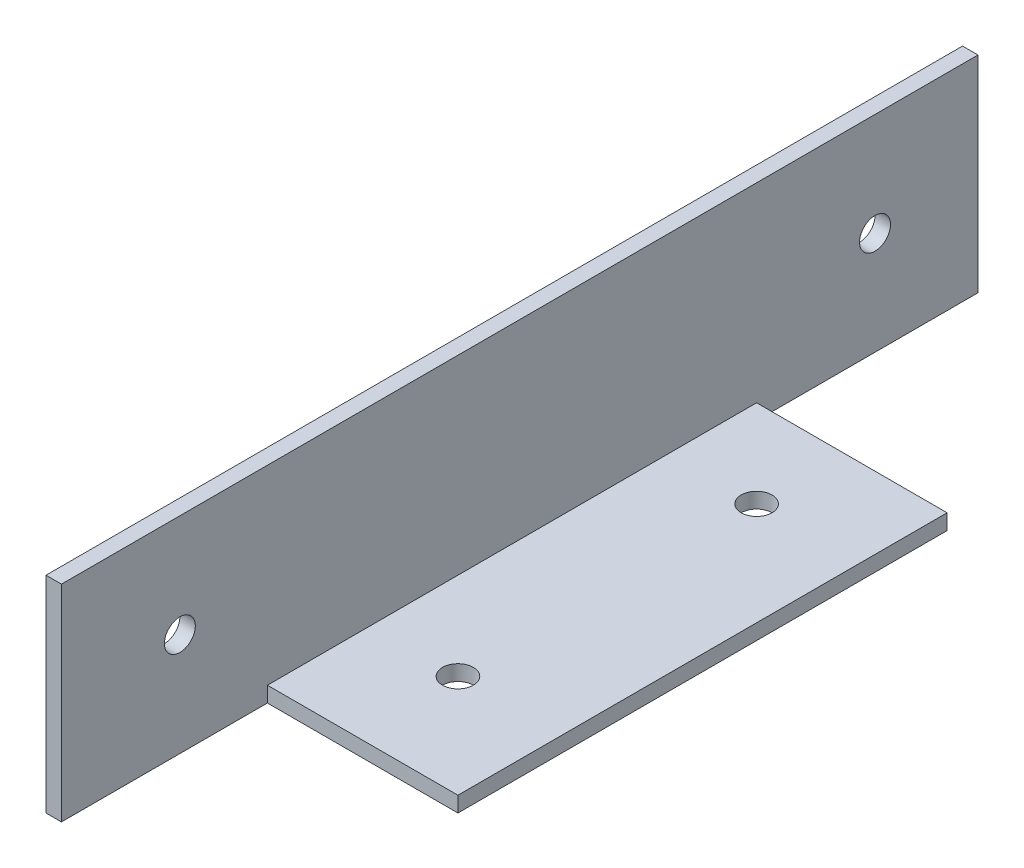
from build123d import *

# Parameters (mm, degrees)
EXTRUSION1_DEPTH = 89
ESQUISSE2_R      = 1.5
ESQUISSE2_W      = 18.5
ESQUISSE2_H      = 20
ESQUISSE2_H_2    = 21.5
EXTRUSION2_DEPTH = 100
ESQUISSE3_R      = 1.5
EXTRUSION3_DEPTH = 100


with BuildPart() as part:
    # Esquisse1 → Extrusion1 (new body)
    with BuildSketch(Plane.XY):
        Polygon((-24.93137059, 6.591473684), (-24.93137059, -13.408526316), (-4.93137059, -13.408526316), (-4.93137059, -11.908526316), (-23.43137059, -11.908526316), (-23.43137059, 6.591473684), align=None)
    extrude(amount=EXTRUSION1_DEPTH)

    # Esquisse2 → Extrusion2 (cut)
    with BuildSketch(Plane(origin=(0, -11.908526316, 0), x_dir=(-1, 0, 0), z_dir=(0, 1, 0))):
        with Locations((14.93137059, 59)):
            Circle(ESQUISSE2_R)
        with Locations((14.93137059, 30)):
            Circle(ESQUISSE2_R)
        with Locations((14.18137059, 79)):
            Rectangle(ESQUISSE2_W, ESQUISSE2_H)
        with Locations((14.18137059, 10.75)):
            Rectangle(ESQUISSE2_W, ESQUISSE2_H_2)
    extrude(amount=-EXTRUSION2_DEPTH, mode=Mode.SUBTRACT)

    # Esquisse3 → Extrusion3 (cut)
    with BuildSketch(Plane(origin=(-23.43137059, 0, 0), x_dir=(0, 0, -1), z_dir=(1, 0, 0))):
        with Locations((-77.5, -3.408526316)):
            Circle(ESQUISSE3_R)
        with Locations((-10, -3.408526316)):
            Circle(ESQUISSE3_R)
    extrude(amount=-EXTRUSION3_DEPTH, mode=Mode.SUBTRACT)


solid = part.part
